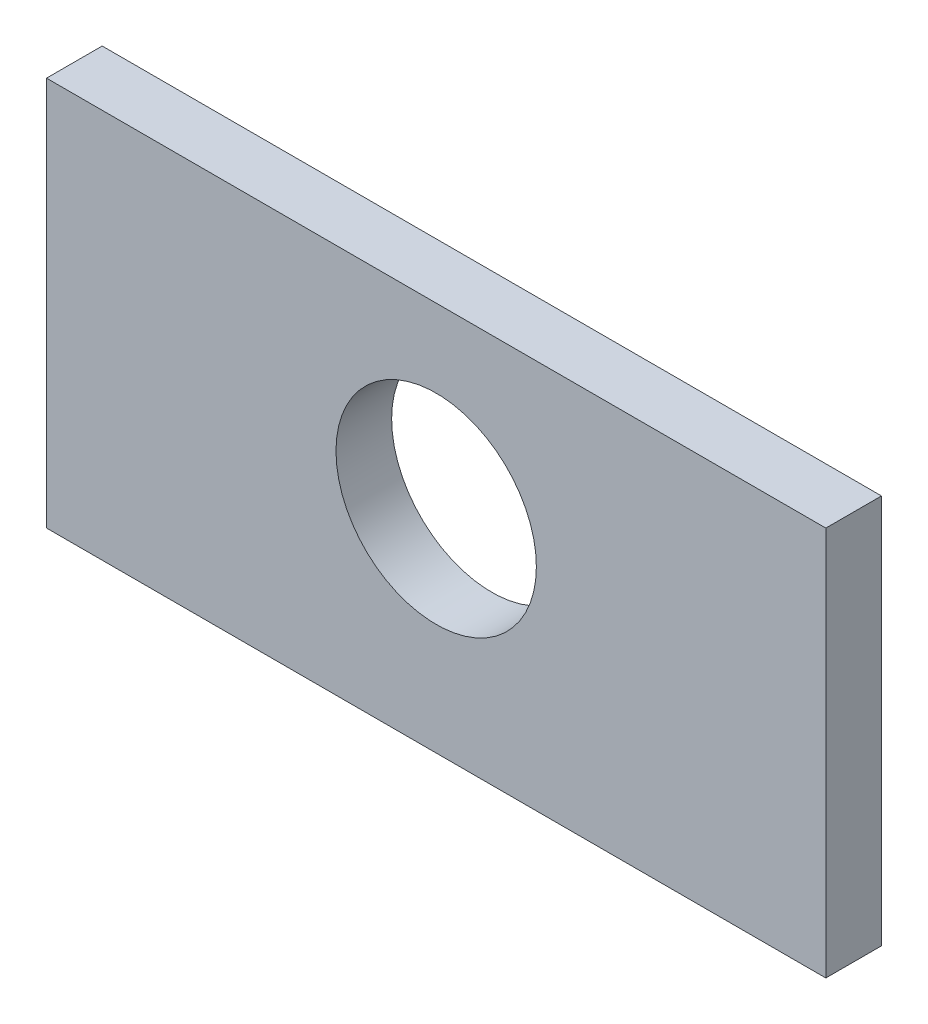
from build123d import *

# Parameters (mm, degrees)
SKETCH_1_W      = 140
SKETCH_1_H      = 70
SKETCH_1_R      = 18
EXTRUDE_1_DEPTH = 5


with BuildPart() as part:
    # Эскиз1 → Бобышка-Вытянуть1 (new, symmetric)
    with BuildSketch(Plane.XY):
        Rectangle(SKETCH_1_W, SKETCH_1_H)
        with Locations((0, 3)):
            Circle(SKETCH_1_R, mode=Mode.SUBTRACT)
    extrude(amount=EXTRUDE_1_DEPTH, both=True)


solid = part.part
